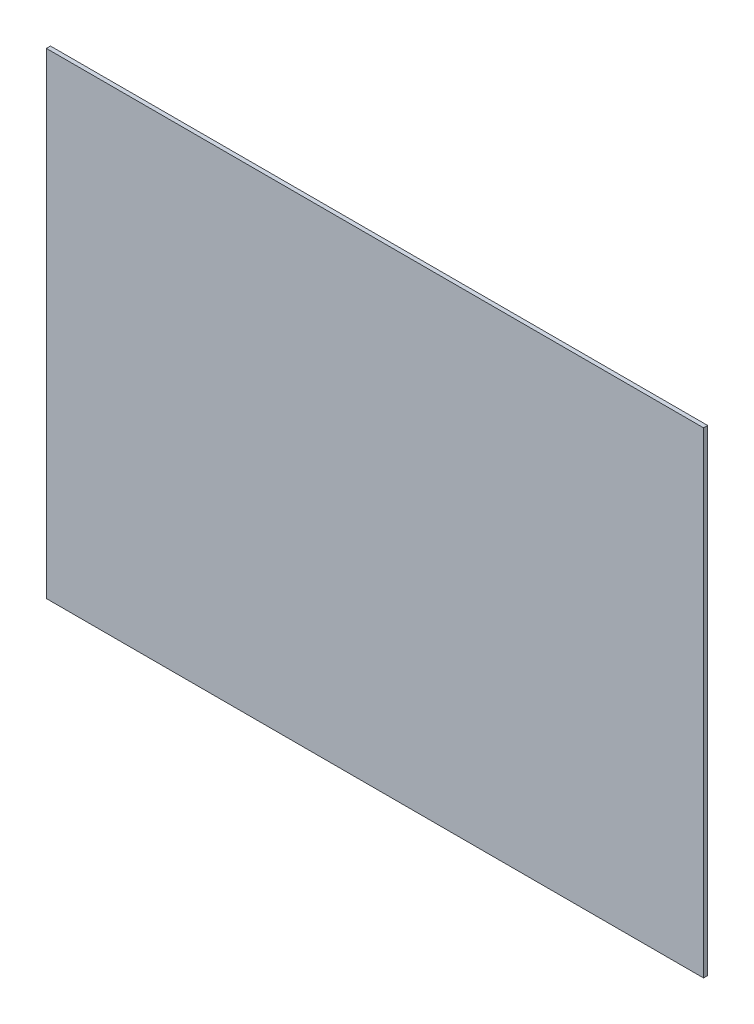
from build123d import *

# Parameters (mm, degrees)
ESQUISSE1_W        = 800
ESQUISSE1_H        = 580
BOSS_EXTRU_1_DEPTH = 5


with BuildPart() as part:
    # Esquisse1 → Boss.-Extru.1 (new body)
    with BuildSketch(Plane.XY):
        Rectangle(ESQUISSE1_W, ESQUISSE1_H)
    extrude(amount=BOSS_EXTRU_1_DEPTH)


solid = part.part
